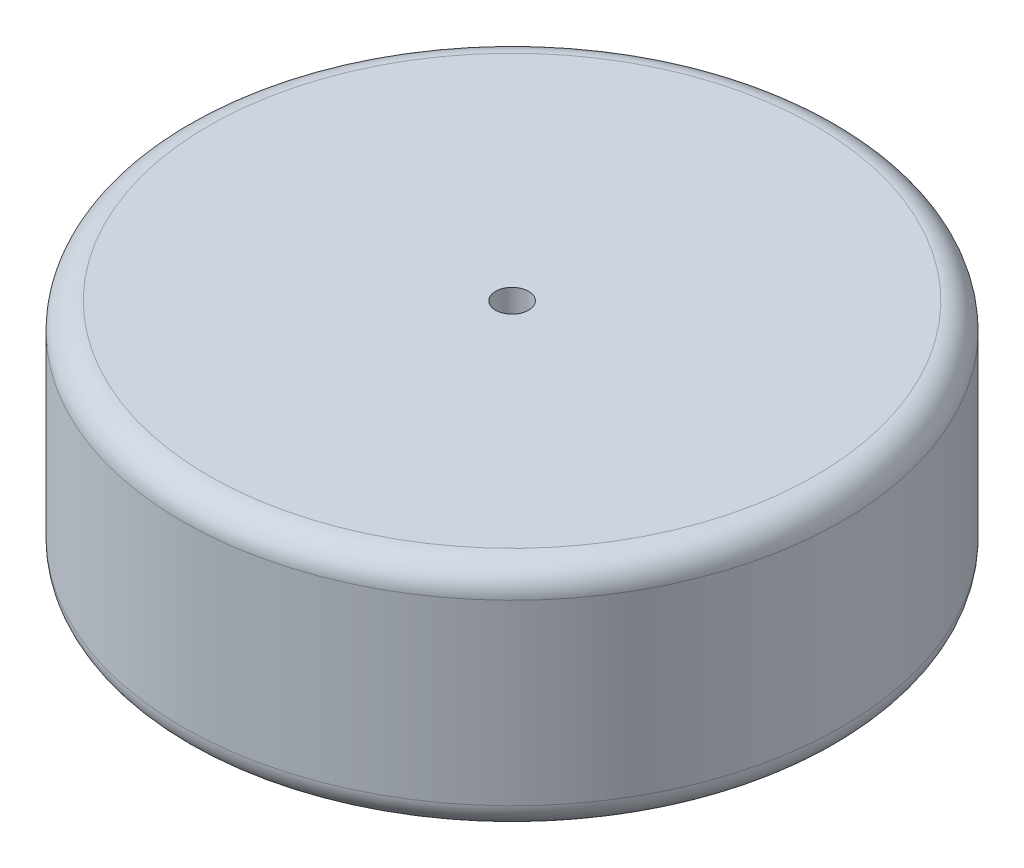
from build123d import *

# Parameters (mm, degrees)
SKETCH_1_R          = 100
EXTRUDE_1_DEPTH     = 70
FILLET_1_R          = 8
SKETCH_2_R          = 5
CUT_EXTRUDE_1_DEPTH = 158.797338444


with BuildPart() as part:
    # 草图1 → 凸台-拉伸1 (new body)
    with BuildSketch(Plane(origin=(0, 0, 0), x_dir=(1, 0, 0), z_dir=(0, 1, 0))):
        with Locations(Location((0, 0, 0), (0, 0, 270))):
            Circle(SKETCH_1_R)
    extrude(amount=EXTRUDE_1_DEPTH)

    # 圆角1
    fillet_1_edges = [part.edges().sort_by_distance(p)[0] for p in [
        (0, 0, -100),
        (0, 70, -100),
    ]]
    fillet(fillet_1_edges, radius=FILLET_1_R)

    # 草图2 → 切除-拉伸1 (cut, through all)
    with BuildSketch(Plane.XZ):
        with Locations(Location((0, 0, 0), (0, 0, 270))):
            Circle(SKETCH_2_R)
    extrude(amount=-CUT_EXTRUDE_1_DEPTH, mode=Mode.SUBTRACT)


solid = part.part
